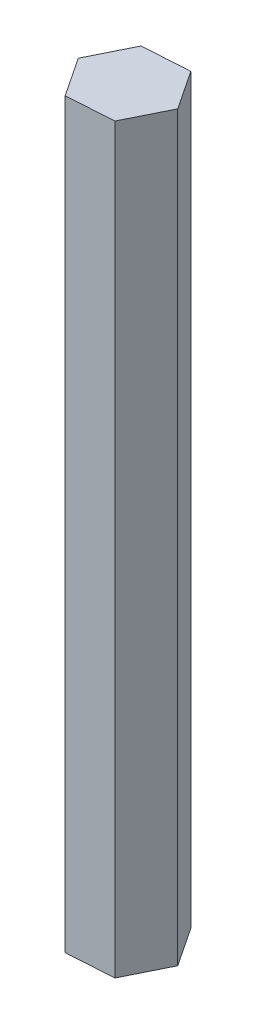
from build123d import *

# Parameters (mm, degrees)
BOSS_EXTRUDE1_DEPTH = 116.078


with BuildPart() as part:
    # Sketch1 → Boss-Extrude1 (new body)
    with BuildSketch(Plane(origin=(0, 0, 0), x_dir=(1, 0, 0), z_dir=(0, 1, 0))):
        Polygon((3.259935789, 6.567811811), (-4.057923981, 6.107093114), (-7.31785977, -0.460718697), (-3.259935789, -6.567811811), (4.057923981, -6.107093114), (7.31785977, 0.460718697), align=None)
    extrude(amount=BOSS_EXTRUDE1_DEPTH)


solid = part.part
